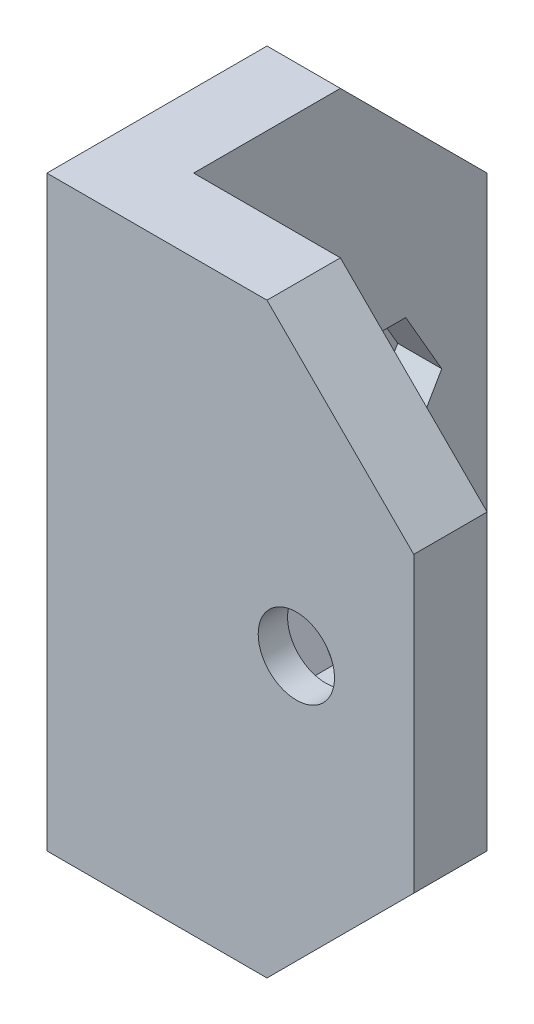
from build123d import *

# Parameters (mm, degrees)
BOSS_EXTRUDE1_DEPTH     = 40
SKETCH2_R               = 2.6
CUT_EXTRUDE1_DEPTH      = 40
CUT_EXTRUDE2_DEPTH      = 3
CUT_EXTRUDE3_DEPTH      = 52.23475383
CUT_EXTRUDE3_DEPTH_BACK = 52.23475383
SKETCH4_R               = 2.6
CUT_EXTRUDE4_DEPTH      = 3
CHAMFER1_SIZE           = 10


with BuildPart() as part:
    # Sketch1 → Boss-Extrude1 (new body)
    with BuildSketch(Plane(origin=(0, 0, 0), x_dir=(1, 0, 0), z_dir=(0, 1, 0))):
        Polygon((0, 0), (25, 0), (25, 5), (5, 5), (5, 25), (0, 25), align=None)
    extrude(amount=BOSS_EXTRUDE1_DEPTH)

    # Sketch2 → Cut-Extrude1 (cut)
    with BuildSketch(Plane(origin=(0, 0, -5), x_dir=(-1, 0, 0), z_dir=(0, 0, -1))):
        with Locations((-17, 20)):
            Circle(SKETCH2_R)
    extrude(amount=-CUT_EXTRUDE1_DEPTH, mode=Mode.SUBTRACT)

    # Sketch3 → Cut-Extrude2 (cut)
    with BuildSketch(Plane(origin=(0, 0, -5), x_dir=(-1, 0, 0), z_dir=(0, 0, -1))):
        Polygon((-14.546261356, 24.25), (-19.453738644, 24.25), (-21.907477288, 20), (-19.453738644, 15.75), (-14.546261356, 15.75), (-12.092522712, 20), align=None)
    extrude(amount=-CUT_EXTRUDE2_DEPTH, mode=Mode.SUBTRACT)

    # Sketch4 → Cut-Extrude3 (cut, two sides: drawn at the far end of the back side and taken through both)
    with BuildSketch(Plane(origin=(5, 0, 0), x_dir=(0, 0, -1), z_dir=(1, 0, 0)).offset(-CUT_EXTRUDE3_DEPTH_BACK)):
        with Locations((17, 20)):
            Circle(SKETCH4_R)
    extrude(amount=CUT_EXTRUDE3_DEPTH + CUT_EXTRUDE3_DEPTH_BACK, mode=Mode.SUBTRACT)

    # Sketch5 → Cut-Extrude4 (cut)
    with BuildSketch(Plane(origin=(5, 0, 0), x_dir=(0, 0, -1), z_dir=(1, 0, 0))):
        Polygon((19.453738644, 24.25), (14.546261356, 24.25), (12.092522712, 20), (14.546261356, 15.75), (19.453738644, 15.75), (21.907477288, 20), align=None)
    extrude(amount=-CUT_EXTRUDE4_DEPTH, mode=Mode.SUBTRACT)

    # Chamfer1
    chamfer1_edges = [part.edges().sort_by_distance(p)[0] for p in [
        (25, 40, -2.5),
        (2.5, 40, -25),
        (2.5, 0, -25),
        (25, 0, -2.5),
    ]]
    chamfer(chamfer1_edges, length=CHAMFER1_SIZE)


solid = part.part
